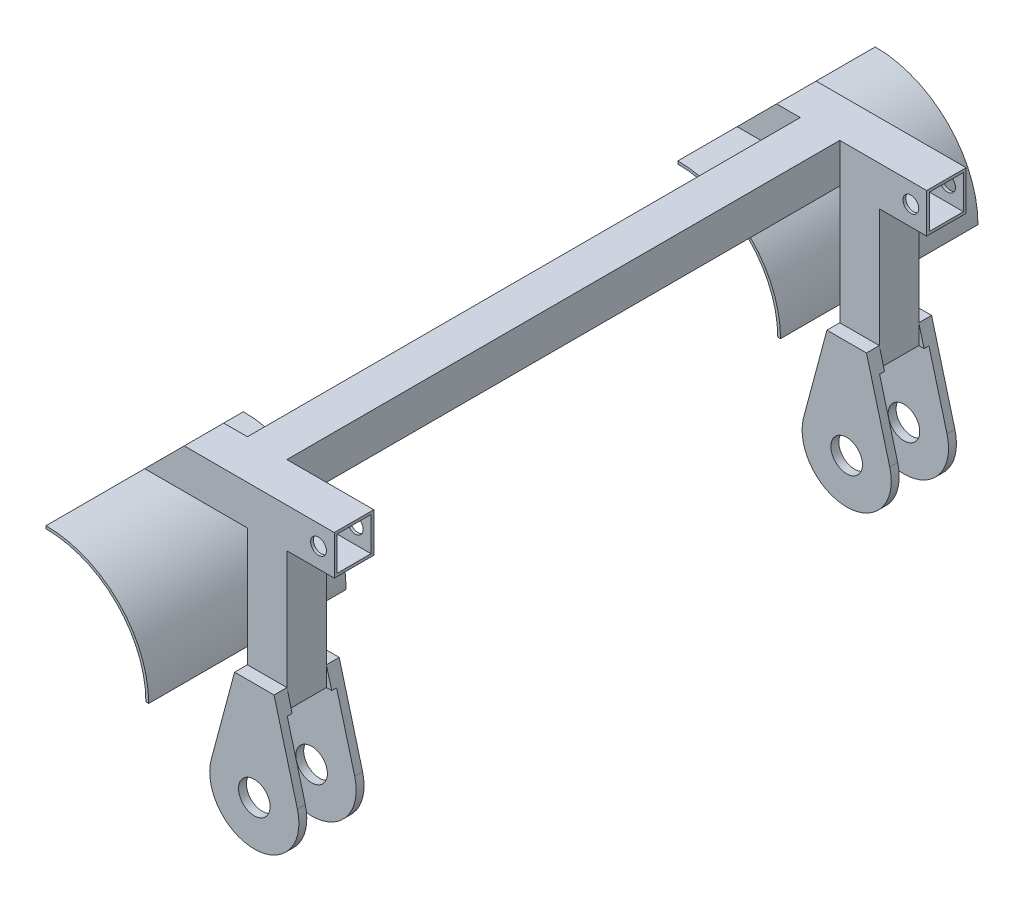
from build123d import *

# Parameters (mm, degrees)
BOSS_EXTRUDE1_DEPTH      = 2
BOSS_EXTRUDE1_DEPTH_BACK = 1.25
SKETCH1_R                = 4
SKETCH2_W                = 10
SKETCH2_H                = 35
BOSS_EXTRUDE2_DEPTH      = 10
SKETCH4_W                = 10
SKETCH4_H                = 10
SKETCH4_W_2              = 8.6
SKETCH4_H_2              = 8.6
BOSS_EXTRUDE3_DEPTH      = 48
SKETCH5_R                = 2
CUT_EXTRUDE1_DEPTH       = 50
BOSS_EXTRUDE4_DEPTH      = 25
CUT_EXTRUDE2_DEPTH       = 50
CUT_EXTRUDE3_DEPTH       = 31
CUT_EXTRUDE3_DEPTH_BACK  = 26
SKETCH14_W               = 1.25
SKETCH14_H               = 34.903307858
SKETCH14_H_2             = 36.088768165
SKETCH15_W               = 10
SKETCH15_H               = 10
BOSS_EXTRUDE7_DEPTH      = 140


with BuildPart() as part:
    # Sketch1 → Boss-Extrude1 (new, two sides: drawn at the far end of the back side and taken through both)
    with BuildSketch(Plane.XY.offset(-BOSS_EXTRUDE1_DEPTH_BACK)):
        with BuildLine():
            Line((-5, 25), (5, 25))
            Line((5, 25), (10.908860009, 2.919234199))
            ThreePointArc((10.908860009, 2.919234199), (0, -11.292703618), (-10.908860009, 2.919234199))
            Line((-10.908860009, 2.919234199), (-5, 25))
        make_face()
        Circle(SKETCH1_R, mode=Mode.SUBTRACT)
    extrude(amount=BOSS_EXTRUDE1_DEPTH + BOSS_EXTRUDE1_DEPTH_BACK)

    # Sketch2 → Boss-Extrude2 (add)
    with BuildSketch(Plane.XY.offset(2)):
        with Locations((0, 37.5)):
            Rectangle(SKETCH2_W, SKETCH2_H)
    extrude(amount=BOSS_EXTRUDE2_DEPTH)

    # Mirror1: part across plane


with BuildPart() as part_1:
    add(part.part)
    add(part.part.mirror(Plane.XY.offset(7)))

    # Sketch4 → Boss-Extrude3 (add)
    with BuildSketch(Plane(origin=(17, 0, 0), x_dir=(0, 0, -1), z_dir=(1, 0, 0))):
        with Locations((-7, 60)):
            Rectangle(SKETCH4_W, SKETCH4_H)
        with Locations((-7, 60)):
            Rectangle(SKETCH4_W_2, SKETCH4_H_2, mode=Mode.SUBTRACT)
    extrude(amount=-BOSS_EXTRUDE3_DEPTH)

    # Sketch5 → Cut-Extrude1 (cut)
    with BuildSketch(Plane.XY.offset(12)):
        with Locations((13, 60)):
            Circle(SKETCH5_R)
    extrude(amount=-CUT_EXTRUDE1_DEPTH, mode=Mode.SUBTRACT)

    # Sketch10 → Cut-Extrude2 (cut)
    with BuildSketch(Plane.XY.offset(12)):
        Polygon((-31, 65), (-31, 55), (-21, 65), align=None)
    extrude(amount=-CUT_EXTRUDE2_DEPTH, mode=Mode.SUBTRACT)

    # Sketch14 → Cut-Extrude3 (cut, two sides: drawn at the far end of the back side and taken through both)
    with BuildSketch(Plane(origin=(5, 0, 0), x_dir=(0, 0, -1), z_dir=(1, 0, 0)).offset(-CUT_EXTRUDE3_DEPTH_BACK)):
        with Locations((-1.375, 2.548346071)):
            Rectangle(SKETCH14_W, SKETCH14_H)
        with Locations((-12.625, 1.955615917)):
            Rectangle(SKETCH14_W, SKETCH14_H_2)
    extrude(amount=CUT_EXTRUDE3_DEPTH + CUT_EXTRUDE3_DEPTH_BACK, mode=Mode.SUBTRACT)


with BuildPart() as body_2:
    # Sketch9 → Boss-Extrude4 (new, symmetric)
    with BuildSketch(Plane.XY.offset(12)):
        with BuildLine():
            ThreePointArc((-5.7, 29), (-13.110198436, 46.889801564), (-31, 54.3))
            Line((-31, 54.3), (-31, 55))
            ThreePointArc((-31, 55), (-12.615223689, 47.384776311), (-5, 29))
            Line((-5, 29), (-5.7, 29))
        make_face()
    extrude(amount=BOSS_EXTRUDE4_DEPTH, both=True)


with BuildPart() as body_3:
    # Mirror2: mirrored copy
    add(part_1.part.mirror(Plane(origin=(0, 0, -68), x_dir=(1, 0, 0), z_dir=(0, 0, -1))))


with BuildPart() as body_4:
    # Mirror2 2: mirrored copy
    add(body_2.part.mirror(Plane(origin=(0, 0, -68), x_dir=(1, 0, 0), z_dir=(0, 0, -1))))


with BuildPart() as part_2:
    add(part_1.part)

    add(body_3.part)  # Boss-Extrude7 merges body 3
    # Sketch15 → Boss-Extrude7 (add)
    with BuildSketch(Plane(origin=(0, 0, 2), x_dir=(-1, 0, 0), z_dir=(0, 0, -1))):
        with Locations((10, 60)):
            Rectangle(SKETCH15_W, SKETCH15_H)
    extrude(amount=BOSS_EXTRUDE7_DEPTH)


solid = Compound([body_2.part, body_4.part, part_2.part])
